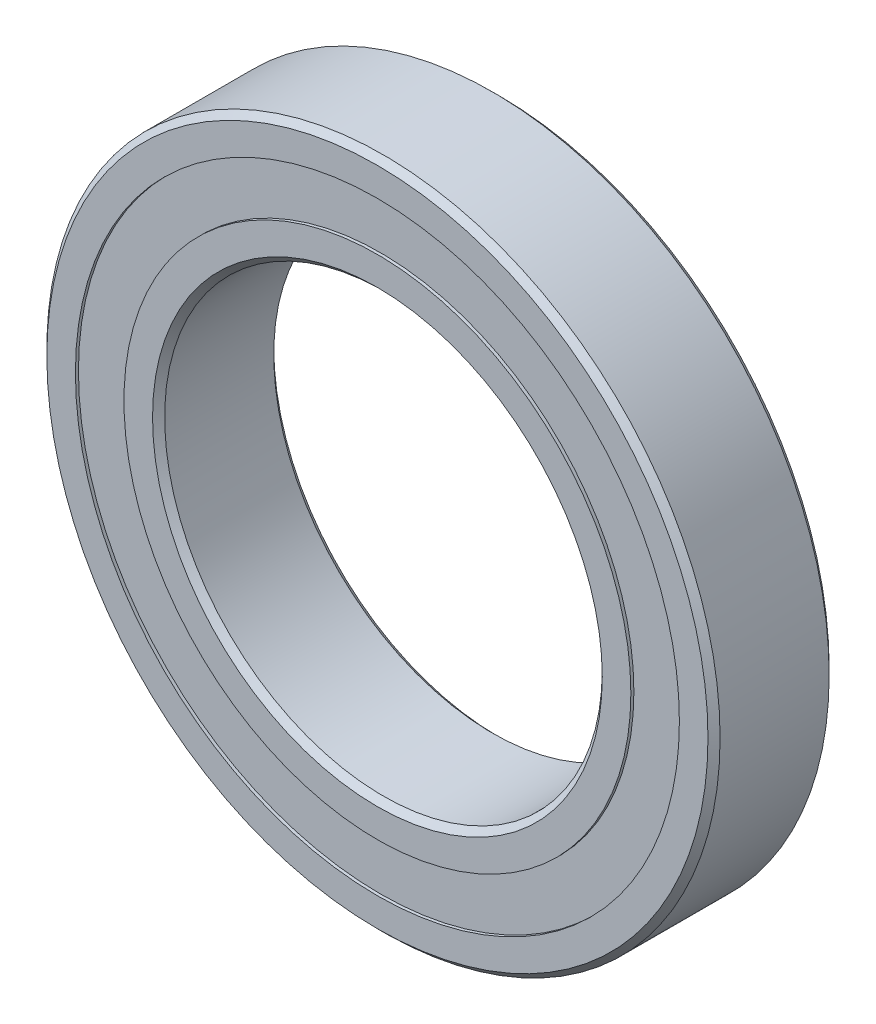
from build123d import *

# Parameters (mm, degrees)
CIRPATTERN1_COUNT = 12
SKETCH5_W         = 3.165608886
SKETCH5_H         = 7.208791208


with BuildPart() as part:
    # Sketch1 → Revolve1 (revolve)
    with BuildSketch(Plane(origin=(0, 0, 0), x_dir=(0, 0, -1), z_dir=(1, 0, 0))):
        with BuildLine():
            Line((8.1, 50), (-8.1, 50))
            Line((-8.1, 50), (-9, 49.1))
            Line((-9, 49.1), (-9, 44.854395604))
            Line((-9, 44.854395604), (-4, 44.854395604))
            ThreePointArc((-4, 44.854395604), (0, 46.634391114), (4, 44.854395604))
            Line((4, 44.854395604), (9, 44.854395604))
            Line((9, 44.854395604), (9, 49.1))
            Line((9, 49.1), (8.1, 50))
        make_face()
    revolve(axis=Axis((0, 0, 9), (0, 0, -1)))


with BuildPart() as body_2:
    # Sketch3 → Revolve3 (revolve)
    with BuildSketch(Plane(origin=(0, 0, 0), x_dir=(0, 0, -1), z_dir=(1, 0, 0))):
        with BuildLine():
            Line((-9, 37.645604396), (-4, 37.645604396))
            ThreePointArc((-4, 37.645604396), (0, 35.865608886), (4, 37.645604396))
            Line((4, 37.645604396), (9, 37.645604396))
            Line((9, 37.645604396), (9, 33.4))
            Line((9, 33.4), (8.1, 32.5))
            Line((8.1, 32.5), (-8.1, 32.5))
            Line((-8.1, 32.5), (-9, 33.4))
            Line((-9, 33.4), (-9, 37.645604396))
        make_face()
    revolve(axis=Axis((0, 0, 9), (0, 0, -1)))


with BuildPart() as body_3:
    # Sketch4 → Revolve4 (revolve)
    with BuildSketch(Plane(origin=(0, 0, 0), x_dir=(0, 0, -1), z_dir=(1, 0, 0))):
        with BuildLine():
            Line((-5.384391114, 41.25), (5.384391114, 41.25))
            ThreePointArc((5.384391114, 41.25), (0, 46.634391114), (-5.384391114, 41.25))
        make_face()
    revolve(axis=Axis((0, 41.25, 5.384391114), (0, 0, -1)))


with BuildPart() as cirpattern1_1:
    # CirPattern1: pattern copy
    add(body_3.part.rotate(Axis((0, 0, -9), (0, 0, 1)), 1 * 360 / CIRPATTERN1_COUNT))


with BuildPart() as cirpattern1_2:
    # CirPattern1: pattern copy
    add(body_3.part.rotate(Axis((0, 0, -9), (0, 0, 1)), 2 * 360 / CIRPATTERN1_COUNT))


with BuildPart() as cirpattern1_3:
    # CirPattern1: pattern copy
    add(body_3.part.rotate(Axis((0, 0, -9), (0, 0, 1)), 3 * 360 / CIRPATTERN1_COUNT))


with BuildPart() as cirpattern1_4:
    # CirPattern1: pattern copy
    add(body_3.part.rotate(Axis((0, 0, -9), (0, 0, 1)), 4 * 360 / CIRPATTERN1_COUNT))


with BuildPart() as cirpattern1_5:
    # CirPattern1: pattern copy
    add(body_3.part.rotate(Axis((0, 0, -9), (0, 0, 1)), 5 * 360 / CIRPATTERN1_COUNT))


with BuildPart() as cirpattern1_6:
    # CirPattern1: pattern copy
    add(body_3.part.rotate(Axis((0, 0, -9), (0, 0, 1)), 6 * 360 / CIRPATTERN1_COUNT))


with BuildPart() as cirpattern1_7:
    # CirPattern1: pattern copy
    add(body_3.part.rotate(Axis((0, 0, -9), (0, 0, 1)), 7 * 360 / CIRPATTERN1_COUNT))


with BuildPart() as cirpattern1_8:
    # CirPattern1: pattern copy
    add(body_3.part.rotate(Axis((0, 0, -9), (0, 0, 1)), 8 * 360 / CIRPATTERN1_COUNT))


with BuildPart() as cirpattern1_9:
    # CirPattern1: pattern copy
    add(body_3.part.rotate(Axis((0, 0, -9), (0, 0, 1)), 9 * 360 / CIRPATTERN1_COUNT))


with BuildPart() as cirpattern1_10:
    # CirPattern1: pattern copy
    add(body_3.part.rotate(Axis((0, 0, -9), (0, 0, 1)), 10 * 360 / CIRPATTERN1_COUNT))


with BuildPart() as cirpattern1_11:
    # CirPattern1: pattern copy
    add(body_3.part.rotate(Axis((0, 0, -9), (0, 0, 1)), 11 * 360 / CIRPATTERN1_COUNT))


with BuildPart() as body_15:
    # Sketch5 → Revolve5 (revolve)
    with BuildSketch(Plane(origin=(0, 0, 0), x_dir=(0, 0, -1), z_dir=(1, 0, 0))):
        with Locations((-6.967195557, 41.25)):
            Rectangle(SKETCH5_W, SKETCH5_H)
        with Locations((6.967195557, 41.25)):
            Rectangle(SKETCH5_W, SKETCH5_H)
    revolve(axis=Axis((0, 0, 9), (0, 0, -1)))


solid = Compound([part.part, body_2.part, body_3.part, cirpattern1_1.part, cirpattern1_2.part, cirpattern1_3.part, cirpattern1_4.part, cirpattern1_5.part, cirpattern1_6.part, cirpattern1_7.part, cirpattern1_8.part, cirpattern1_9.part, cirpattern1_10.part, cirpattern1_11.part, body_15.part])
